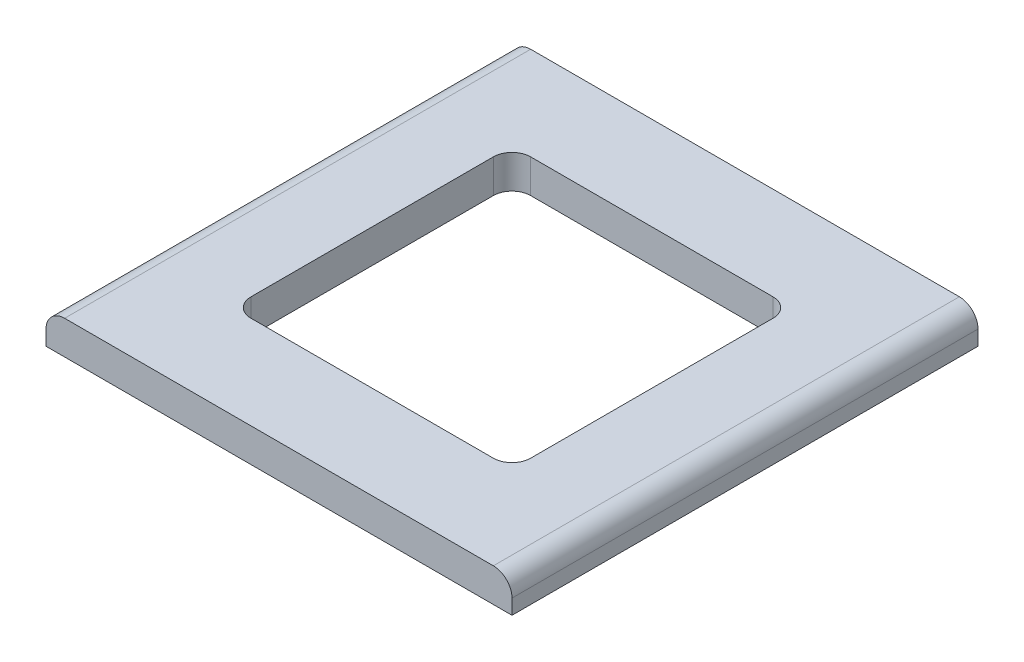
from build123d import *

# Parameters (mm, degrees)
SKETCH_1_W      = 250
SKETCH_1_H      = 250
SKETCH_1_W_2    = 150
SKETCH_1_H_2    = 150
EXTRUDE_1_DEPTH = 18
FILLET_1_R      = 10
FILLET_2_R      = 10


with BuildPart() as part:
    # 草图1 → 凸台-拉伸1 (new body)
    with BuildSketch(Plane(origin=(0, 0, 0), x_dir=(1, 0, 0), z_dir=(0, 1, 0))):
        Rectangle(SKETCH_1_W, SKETCH_1_H)
        Rectangle(SKETCH_1_W_2, SKETCH_1_H_2, mode=Mode.SUBTRACT)
    extrude(amount=EXTRUDE_1_DEPTH)

    # 圆角1
    fillet_1_edges = [part.edges().sort_by_distance(p)[0] for p in [
        (125, 18, 0),
        (-125, 18, 0),
    ]]
    fillet(fillet_1_edges, radius=FILLET_1_R)

    # 圆角2
    fillet_2_edges = [part.edges().sort_by_distance(p)[0] for p in [
        (-75, 9, -75),
        (-75, 9, 75),
        (75, 9, 75),
        (75, 9, -75),
    ]]
    fillet(fillet_2_edges, radius=FILLET_2_R)


solid = part.part
